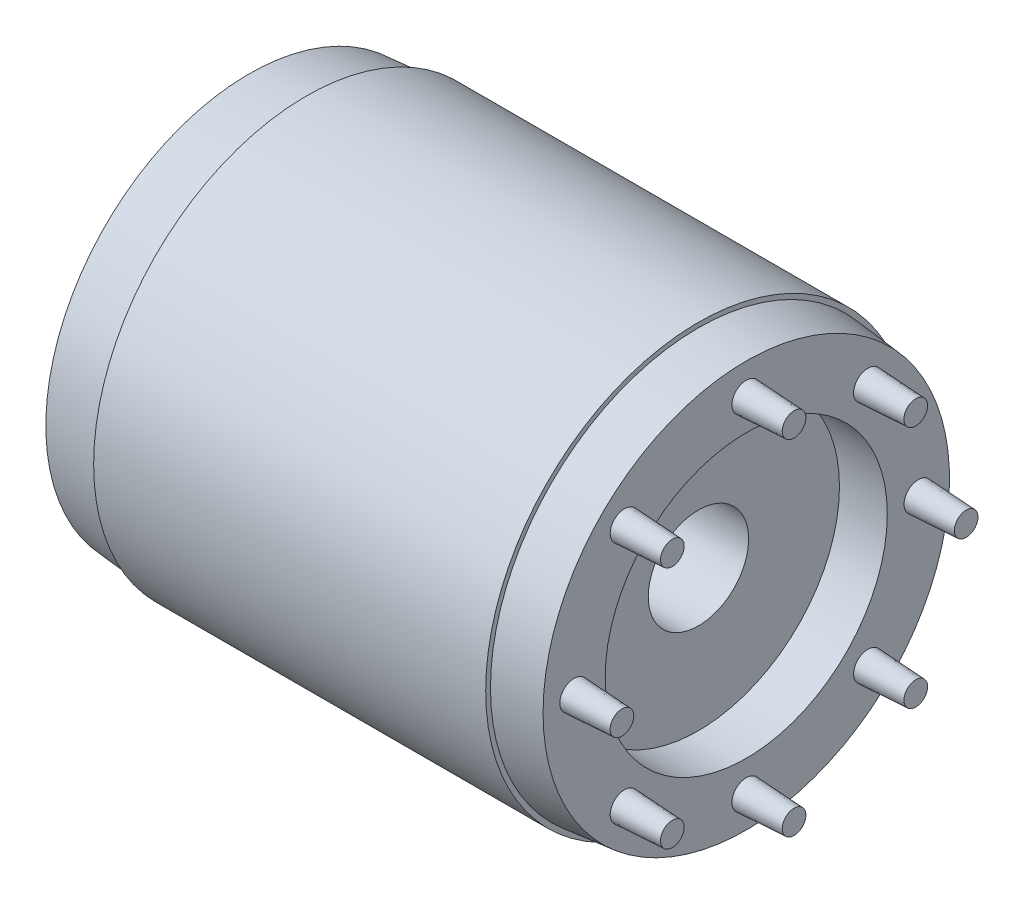
from build123d import *

# Parameters (mm, degrees)
ESBO_O2_R         = 3
EXTRUS_O1_DEPTH   = 10
EXTRUS_O1_TAPER   = 3
CIRPATTERN1_COUNT = 8


with BuildPart() as part:
    # Esboço1 → Revolução1 (revolve)
    with BuildSketch(Plane.XY):
        Polygon((0, 10.5), (82, 10.5), (82, 29.5), (92, 29.5), (92, 42.5), (82, 43.5), (82, 44.5), (0, 44.5), (0, 43.5), (-12, 42.5), (-12, 35.5), (-3.89618766, 35.5), (-3.89618766, 29.5), (0, 29.5), align=None)
    revolve(axis=Axis((0, 0, 0), (1, 0, 0)))

    # Esboço2 → Extrusão1 (add)
    with BuildSketch(Plane(origin=(92, 0, 0), x_dir=(0, 0, -1), z_dir=(1, 0, 0))):
        with Locations((0, 36)):
            Circle(ESBO_O2_R)
    extrus_o1 = extrude(amount=EXTRUS_O1_DEPTH, taper=EXTRUS_O1_TAPER)

    # CirPattern1: Extrusão1 ×8 about axis
    cirpattern1_axis = Axis((0, 0, 0), (1, 0, 0))
    for i in range(1, CIRPATTERN1_COUNT):
        add(extrus_o1.rotate(cirpattern1_axis, i * 360 / CIRPATTERN1_COUNT))


solid = part.part
